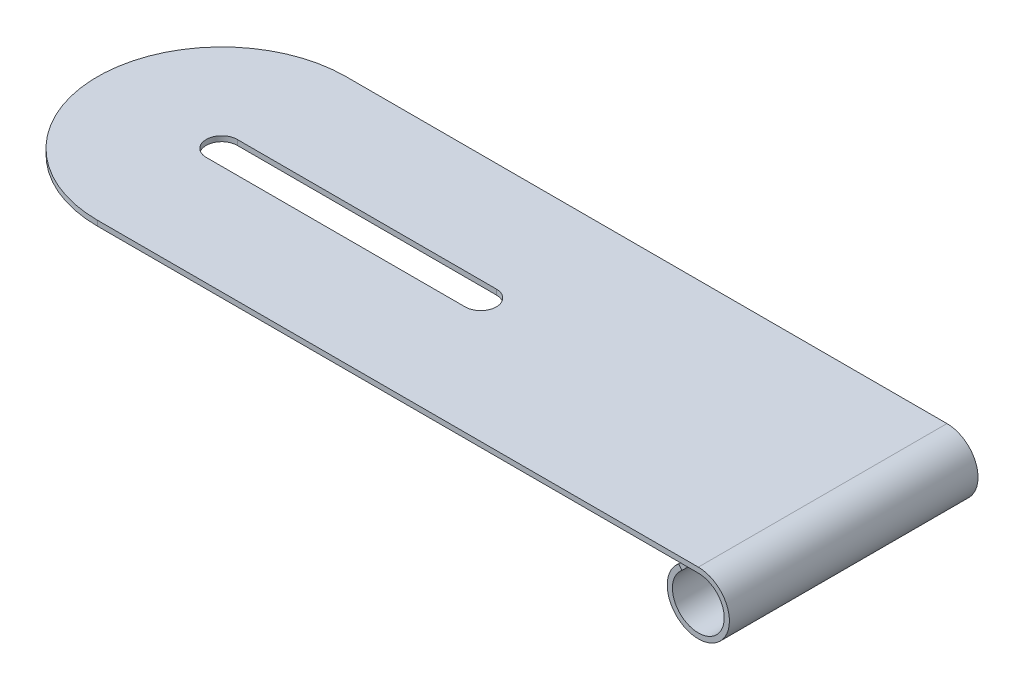
from build123d import *

# Parameters (mm, degrees)
SALIENTE_EXTRUIR1_DEPTH = 24
CORTAR_EXTRUIR1_DEPTH   = 1


with BuildPart() as part:
    # Croquis1 → Saliente-Extruir1 (new body)
    with BuildSketch(Plane.XY):
        with BuildLine():
            Line((0, 3), (-70, 3))
            Line((-70, 3), (-70, 2.5))
            Line((-70, 2.5), (0, 2.5))
            ThreePointArc((0, 2.5), (0.835770646, -2.356159466), (-1.575367134, 1.941189942))
            Line((-1.575367134, 1.941189942), (-1.890440561, 2.329427931))
            ThreePointArc((-1.890440561, 2.329427931), (1.002924775, -2.827391359), (0, 3))
        make_face()
    extrude(amount=SALIENTE_EXTRUIR1_DEPTH)

    # Croquis2 → Cortar-Extruir1 (cut)
    with BuildSketch(Plane(origin=(0, 3, 0), x_dir=(1, 0, 0), z_dir=(0, 1, 0))):
        with BuildLine():
            Line((-58, -10.5), (-33, -10.5))
            ThreePointArc((-33, -10.5), (-31.5, -12), (-33, -13.5))
            Line((-33, -13.5), (-58, -13.5))
            ThreePointArc((-58, -13.5), (-59.5, -12), (-58, -10.5))
        make_face()
        with BuildLine():
            Line((-58, 0), (-75.765424477, 0))
            Line((-75.765424477, 0), (-75.765424477, -24))
            Line((-75.765424477, -24), (-58, -24))
            ThreePointArc((-58, -24), (-70, -12), (-58, 0))
        make_face()
    extrude(amount=-CORTAR_EXTRUIR1_DEPTH, mode=Mode.SUBTRACT)


solid = part.part
